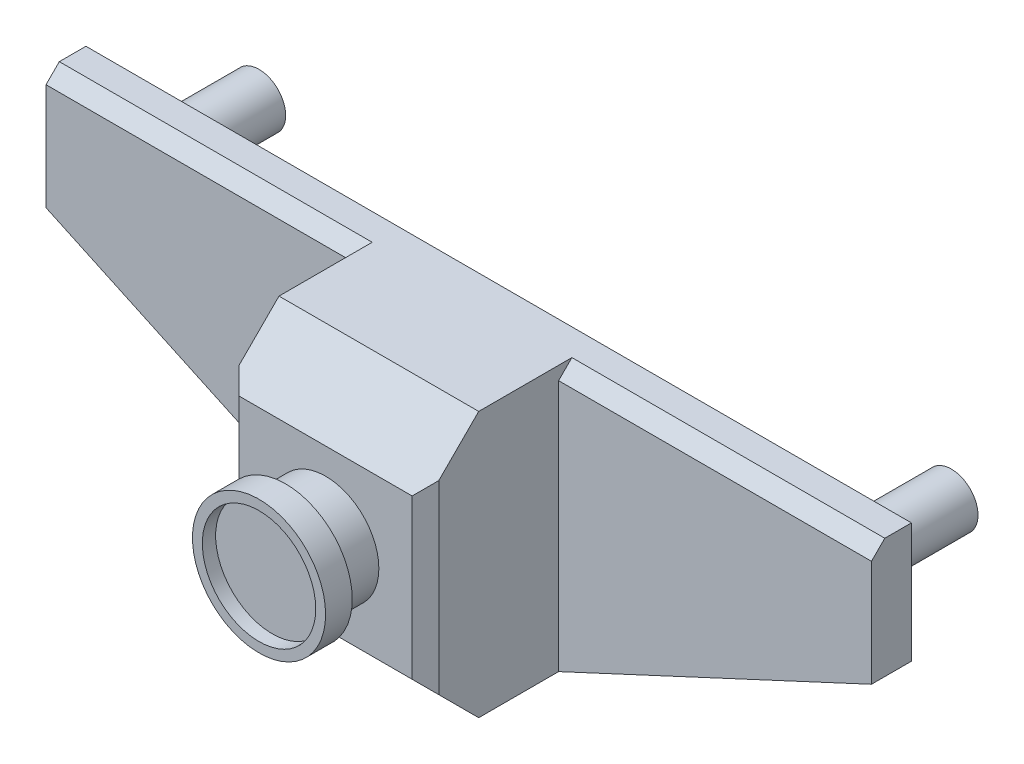
from build123d import *

# Parameters (mm, degrees)
SALIENTE_EXTRUIR2_DEPTH = 3
CROQUIS2_R              = 2
SALIENTE_EXTRUIR3_DEPTH = 8
CROQUIS3_W              = 15
CROQUIS3_H              = 19.925925926
SALIENTE_EXTRUIR4_DEPTH = 10
CHAFL_N1_SIZE           = 4
CHAFL_N2_SIZE           = 1
CROQUIS4_R              = 4
SALIENTE_EXTRUIR5_DEPTH = 3
CROQUIS5_R              = 5
SALIENTE_EXTRUIR6_DEPTH = 2
CROQUIS6_R              = 4.259259259
CORTAR_EXTRUIR1_DEPTH   = 1
CHAFL_N3_SIZE           = 1


with BuildPart() as part:
    # Croquis1 → Saliente-Extruir2 (new body)
    with BuildSketch(Plane.XY):
        Polygon((-15.510753344, -3.296296296), (7.989246656, -14.222222222), (22.989246656, -14.222222222), (46.489246656, -3.296296296), (46.489246656, 5.703703704), (-15.510753344, 5.703703704), align=None)
    extrude(amount=SALIENTE_EXTRUIR2_DEPTH)

    # Croquis2 → Saliente-Extruir3 (add)
    with BuildSketch(Plane(origin=(0, 0, 0), x_dir=(-1, 0, 0), z_dir=(0, 0, -1))):
        with Locations(Location((-41.489246656, 0.703703704, 0), (0, 0, 180))):
            Circle(CROQUIS2_R)
        with Locations(Location((10.510753344, 0.703703704, 0), (0, 0, 180))):
            Circle(CROQUIS2_R)
    extrude(amount=SALIENTE_EXTRUIR3_DEPTH)

    # Croquis3 → Saliente-Extruir4 (add)
    with BuildSketch(Plane.XY.offset(3)):
        with Locations((15.489246656, -4.259259259)):
            Rectangle(CROQUIS3_W, CROQUIS3_H)
    extrude(amount=SALIENTE_EXTRUIR4_DEPTH)

    # Chaflán1
    chafl_n1_edges = [part.edges().sort_by_distance(p)[0] for p in [
        (15.489246656, -14.222222222, 13),
        (15.489246656, 5.703703704, 13),
    ]]
    chamfer(chafl_n1_edges, length=CHAFL_N1_SIZE)

    # Chaflán2
    chafl_n2_edges = [part.edges().sort_by_distance(p)[0] for p in [
        (7.989246656, -4.259259259, 13),
        (22.989246656, -4.259259259, 13),
    ]]
    chamfer(chafl_n2_edges, length=CHAFL_N2_SIZE)

    # Croquis4 → Saliente-Extruir5 (add)
    with BuildSketch(Plane.XY.offset(13)):
        with Locations((15.489246656, -4.259259259)):
            Circle(CROQUIS4_R)
    extrude(amount=SALIENTE_EXTRUIR5_DEPTH)

    # Croquis5 → Saliente-Extruir6 (add)
    with BuildSketch(Plane.XY.offset(16)):
        with Locations((15.489246656, -4.259259259)):
            Circle(CROQUIS5_R)
    extrude(amount=SALIENTE_EXTRUIR6_DEPTH)

    # Croquis6 → Cortar-Extruir1 (cut)
    with BuildSketch(Plane.XY.offset(18)):
        with Locations((15.489246656, -4.259259259)):
            Circle(CROQUIS6_R)
    extrude(amount=-CORTAR_EXTRUIR1_DEPTH, mode=Mode.SUBTRACT)

    # Chaflán3
    chafl_n3_edges = [part.edges().sort_by_distance(p)[0] for p in [
        (34.739246656, 5.703703704, 3),
        (-3.760753344, 5.703703704, 3),
    ]]
    chamfer(chafl_n3_edges, length=CHAFL_N3_SIZE)


solid = part.part
